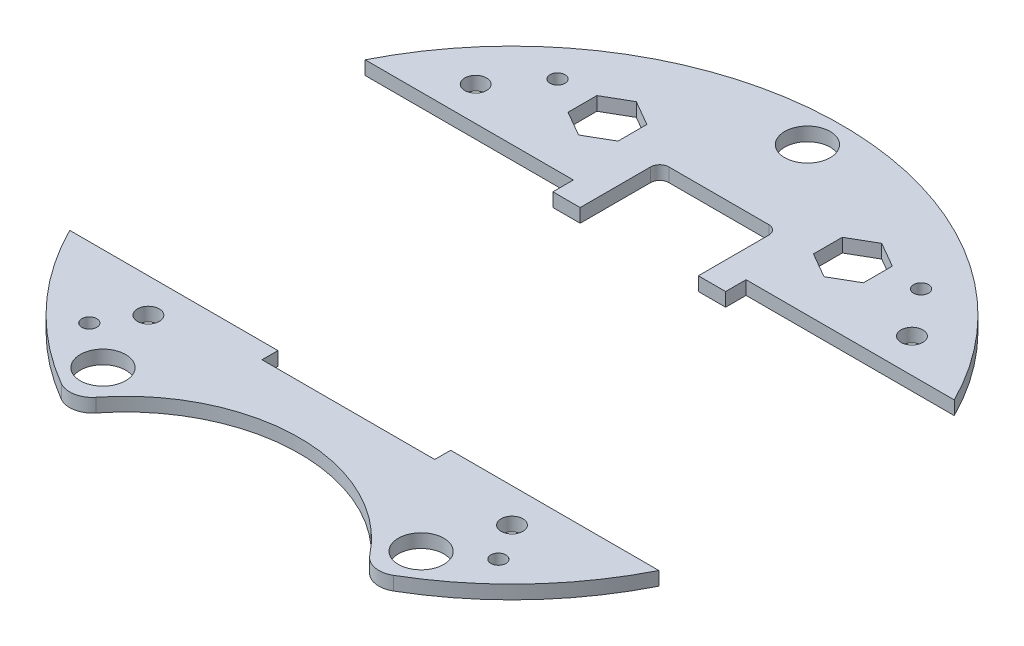
from build123d import *

# Parameters (mm, degrees)
BOSS_EXTRUDE1_DEPTH  = 3
SOLENOID_PLACEMENT_W = 38
SOLENOID_PLACEMENT_H = 64
CUT_EXTRUDE1_DEPTH   = 103.574363269
CUT_EXTRUDE4_DEPTH   = 103.574363269
CUT_EXTRUDE5_DEPTH   = 103.574363269
SKETCH6_R            = 2.4
CUT_EXTRUDE6_DEPTH   = 103.574363269
CUT_EXTRUDE3_DEPTH   = 103.574363269
SKETCH7_R            = 5
CUT_EXTRUDE7_DEPTH   = 98.289516393
SKETCH8_R            = 5
CUT_EXTRUDE9_DEPTH   = 98.289516393
SKETCH9_R            = 1.65
CUT_EXTRUDE10_DEPTH  = 98.289516393


with BuildPart() as part:
    # Sketch1 → Boss-Extrude1 (new body)
    with BuildSketch(Plane(origin=(0, 0, 0), x_dir=(1, 0, 0), z_dir=(0, 1, 0))):
        with BuildLine():
            ThreePointArc((36.543377003, -62.616544118), (0, 72.5), (-36.543377003, -62.616544118))
            ThreePointArc((-36.543377003, -62.616544118), (-33.085954668, -63.20954405), (-30.089832649, -61.38507948))
            ThreePointArc((-30.089832649, -61.38507948), (0, -46.75), (30.089832649, -61.38507948))
            ThreePointArc((30.089832649, -61.38507948), (33.085954668, -63.20954405), (36.543377003, -62.616544118))
        make_face()
    extrude(amount=BOSS_EXTRUDE1_DEPTH)

    # solenoid placement → Cut-Extrude1 (cut, through all)
    with BuildSketch(Plane(origin=(0, 3, 0), x_dir=(1, 0, 0), z_dir=(0, 1, 0))):
        with Locations((0, -4)):
            Rectangle(SOLENOID_PLACEMENT_W, SOLENOID_PLACEMENT_H)
    extrude(amount=-CUT_EXTRUDE1_DEPTH, mode=Mode.SUBTRACT)

    # Sketch4 → Cut-Extrude4 (cut, through all)
    with BuildSketch(Plane(origin=(0, 3, 0), x_dir=(1, 0, 0), z_dir=(0, 1, 0))):
        with BuildLine():
            Line((13, 28), (13, 43.5))
            ThreePointArc((13, 43.5), (12.414213562, 44.914213562), (11, 45.5))
            Line((11, 45.5), (-11, 45.5))
            ThreePointArc((-11, 45.5), (-12.414213562, 44.914213562), (-13, 43.5))
            Line((-13, 43.5), (-13, 28))
            Line((-13, 28), (13, 28))
        make_face()
    extrude(amount=-CUT_EXTRUDE4_DEPTH, mode=Mode.SUBTRACT)

    # Sketch5 → Cut-Extrude5 (cut, through all)
    with BuildSketch(Plane(origin=(0, 3, 0), x_dir=(1, 0, 0), z_dir=(0, 1, 0))):
        Polygon((-21.5, 51.175426481), (-27, 54.350852961), (-32.5, 51.175426481), (-32.5, 44.824573519), (-27, 41.649147039), (-21.5, 44.824573519), align=None)
        Polygon((21.5, 51.175426481), (21.5, 44.824573519), (27, 41.649147039), (32.5, 44.824573519), (32.5, 51.175426481), (27, 54.350852961), align=None)
    extrude(amount=-CUT_EXTRUDE5_DEPTH, mode=Mode.SUBTRACT)

    # Sketch6 → Cut-Extrude6 (cut, through all)
    with BuildSketch(Plane(origin=(0, 3, 0), x_dir=(1, 0, 0), z_dir=(0, 1, 0))):
        with Locations(Location((40, -40, 0), (0, 0, 270))):
            Circle(SKETCH6_R)
        with Locations(Location((-40, -40, 0), (0, 0, 270))):
            Circle(SKETCH6_R)
        with Locations(Location((48, 40, 0), (0, 0, 270))):
            Circle(SKETCH6_R)
        with Locations(Location((-48, 40, 0), (0, 0, 270))):
            Circle(SKETCH6_R)
    extrude(amount=-CUT_EXTRUDE6_DEPTH, mode=Mode.SUBTRACT)

    # Sketch3 → Cut-Extrude3 (cut, through all)
    with BuildSketch(Plane(origin=(0, 3, 0), x_dir=(1, 0, 0), z_dir=(0, 1, 0))):
        Polygon((-19, 28), (-19, 32.5), (-72.5, 32.5), (-72.5, -32.5), (72.5, -32.5), (72.5, 32.5), (19, 32.5), (19, 28), align=None)
    extrude(amount=-CUT_EXTRUDE3_DEPTH, mode=Mode.SUBTRACT)


with BuildPart() as cut_extrude3_piece_1:
    # of the separate pieces the step leaves, piece 1, a body of its own (cut_extrude3_pieces)
    add(part.part.solids().sort_by_distance((64.807406984, 0, -32.5))[0])

    # Sketch8 → Cut-Extrude9 (cut, through all)
    with BuildSketch(Plane.XZ.offset(-3)):
        with Locations(Location((0, -65, 0), (0, 0, 270))):
            Circle(SKETCH8_R)
    extrude(amount=CUT_EXTRUDE9_DEPTH, mode=Mode.SUBTRACT)


with BuildPart() as cut_extrude3_piece_2:
    # of the separate pieces the step leaves, piece 2, a body of its own (cut_extrude3_pieces)
    add(part.part.solids().sort_by_distance((-36.543377003, 0, 62.616544118))[0])

    # Sketch7 → Cut-Extrude7 (cut, through all)
    with BuildSketch(Plane(origin=(0, 3, 0), x_dir=(1, 0, 0), z_dir=(0, 1, 0))):
        with Locations(Location((35, -55, 0), (0, 0, 270))):
            Circle(SKETCH7_R)
        with Locations(Location((-35, -55, 0), (0, 0, 270))):
            Circle(SKETCH7_R)
    extrude(amount=-CUT_EXTRUDE7_DEPTH, mode=Mode.SUBTRACT)


with BuildPart() as cut_extrude10_tool:
    # Sketch9 → Cut-Extrude10 (new, through all)
    with BuildSketch(Plane(origin=(0, 3, 0), x_dir=(1, 0, 0), z_dir=(0, 1, 0))):
        with Locations(Location((45, -48, 0), (0, 0, 270))):
            Circle(SKETCH9_R)
        with Locations(Location((-45, -48, 0), (0, 0, 90))):
            Circle(SKETCH9_R)
        with Locations(Location((40, 50, 0), (0, 0, 270))):
            Circle(SKETCH9_R)
        with Locations(Location((-40, 50, 0), (0, 0, 90))):
            Circle(SKETCH9_R)
    extrude(amount=-CUT_EXTRUDE10_DEPTH)


with BuildPart() as cut_extrude3_piece_1_1:
    add(cut_extrude3_piece_1.part)

    # Cut-Extrude10: cut by cut_extrude10_tool
    add(cut_extrude10_tool.part, mode=Mode.SUBTRACT)


with BuildPart() as cut_extrude3_piece_2_1:
    add(cut_extrude3_piece_2.part)

    # Cut-Extrude10: cut by cut_extrude10_tool
    add(cut_extrude10_tool.part, mode=Mode.SUBTRACT)


solid = Compound([cut_extrude3_piece_1_1.part, cut_extrude3_piece_2_1.part])
